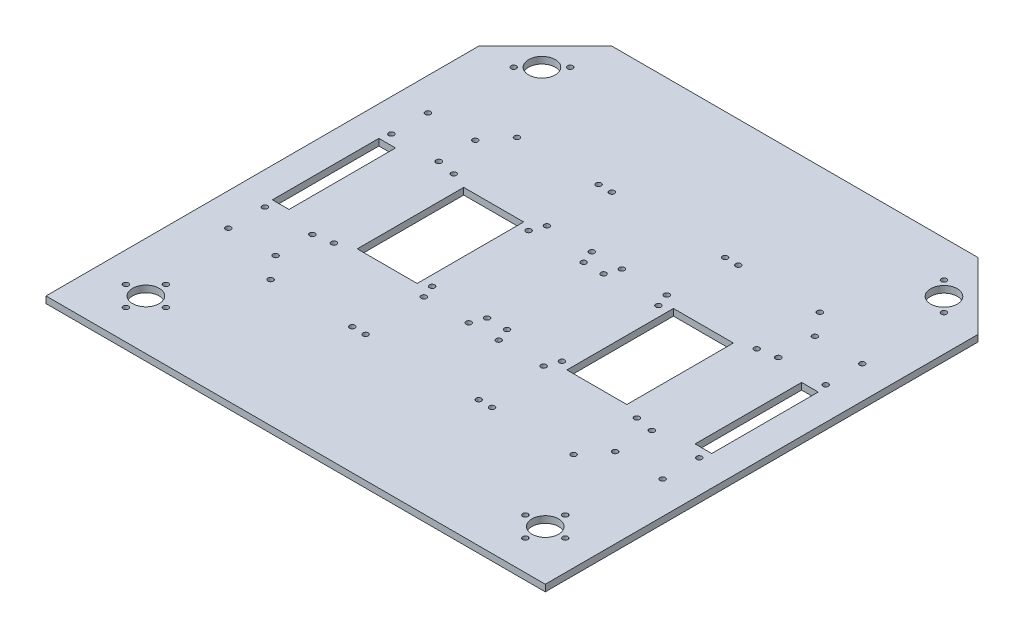
from build123d import *

# Parameters (mm, degrees)
ESQUISSE1_R             = 8
ESQUISSE1_R_2           = 1.6
BOSS_EXTRU_1_DEPTH      = 4
ESQUISSE3_R             = 1.6
ENL_V_MAT_EXTRU_1_DEPTH = 10
ESQUISSE4_W             = 36
ESQUISSE4_H             = 64
ENL_V_MAT_EXTRU_2_DEPTH = 5
ESQUISSE5_R             = 1.6
ENL_V_MAT_EXTRU_4_DEPTH = 5
ESQUISSE6_R             = 1.6
ESQUISSE6_R_2           = 1.621897971
ENL_V_MAT_EXTRU_5_DEPTH = 5
ENL_V_MAT_EXTRU_6_DEPTH = 5


with BuildPart() as part:
    # Esquisse1 → Boss.-Extru.1 (new body)
    with BuildSketch(Plane(origin=(0, 0, 0), x_dir=(1, 0, 0), z_dir=(0, 1, 0))):
        Polygon((-150, 0), (-150, 260), (-110, 300), (110, 300), (150, 260), (150, 0), align=None)
        with Locations((-119.984856992, 30)):
            Circle(ESQUISSE1_R, mode=Mode.SUBTRACT)
        with Locations((-120, 268)):
            Circle(ESQUISSE1_R, mode=Mode.SUBTRACT)
        with Locations((120, 269.55960862)):
            Circle(ESQUISSE1_R, mode=Mode.SUBTRACT)
        with Locations((-111.514718626, 276.485281374)):
            Circle(ESQUISSE1_R_2, mode=Mode.SUBTRACT)
        with Locations((-128.485281374, 259.514718626)):
            Circle(ESQUISSE1_R_2, mode=Mode.SUBTRACT)
        with Locations((111.514718626, 278.044889994)):
            Circle(ESQUISSE1_R_2, mode=Mode.SUBTRACT)
        with Locations((128.485281374, 261.074327245)):
            Circle(ESQUISSE1_R_2, mode=Mode.SUBTRACT)
        with Locations((120, 30)):
            Circle(ESQUISSE1_R, mode=Mode.SUBTRACT)
        with Locations((120, 42)):
            Circle(ESQUISSE1_R_2, mode=Mode.SUBTRACT)
        with Locations((-119.984856992, 42)):
            Circle(ESQUISSE1_R_2, mode=Mode.SUBTRACT)
        with Locations((-119.984856992, 18)):
            Circle(ESQUISSE1_R_2, mode=Mode.SUBTRACT)
        with Locations((120, 18)):
            Circle(ESQUISSE1_R_2, mode=Mode.SUBTRACT)
        with Locations((-131.984856992, 30)):
            Circle(ESQUISSE1_R_2, mode=Mode.SUBTRACT)
        with Locations((-107.984856992, 30)):
            Circle(ESQUISSE1_R_2, mode=Mode.SUBTRACT)
        with Locations((108, 30)):
            Circle(ESQUISSE1_R_2, mode=Mode.SUBTRACT)
        with Locations((132, 30)):
            Circle(ESQUISSE1_R_2, mode=Mode.SUBTRACT)
    extrude(amount=BOSS_EXTRU_1_DEPTH)

    # Esquisse3 → Enlèv. mat.-Extru.1 (cut)
    with BuildSketch(Plane(origin=(0, 4, 0), x_dir=(1, 0, 0), z_dir=(0, 1, 0))):
        with Locations((-9, 113)):
            Circle(ESQUISSE3_R)
        with Locations((-6, 179)):
            Circle(ESQUISSE3_R)
        with Locations((-39, 179)):
            Circle(ESQUISSE3_R)
        with Locations((-36, 113)):
            Circle(ESQUISSE3_R)
        with Locations((9, 187)):
            Circle(ESQUISSE3_R)
        with Locations((36, 187)):
            Circle(ESQUISSE3_R)
        with Locations((39, 121)):
            Circle(ESQUISSE3_R)
        with Locations((6, 121)):
            Circle(ESQUISSE3_R)
    enl_v_mat_extru_1 = extrude(amount=-ENL_V_MAT_EXTRU_1_DEPTH, mode=Mode.SUBTRACT)

    # Esquisse4 → Enlèv. mat.-Extru.2 (cut)
    with BuildSketch(Plane(origin=(0, 4, 0), x_dir=(1, 0, 0), z_dir=(0, 1, 0))):
        with Locations((-63, 150)):
            Rectangle(ESQUISSE4_W, ESQUISSE4_H)
        with Locations((63, 150)):
            Rectangle(ESQUISSE4_W, ESQUISSE4_H)
    extrude(amount=-ENL_V_MAT_EXTRU_2_DEPTH, mode=Mode.SUBTRACT)

    # Symétrie1: Enlèv. mat.-Extru.1 across plane
    add(enl_v_mat_extru_1.mirror(Plane(origin=(0, 0, 0), x_dir=(0, 0, 1), z_dir=(1, 0, 0))), mode=Mode.SUBTRACT)

    # Esquisse5 → Enlèv. mat.-Extru.4 (cut)
    with BuildSketch(Plane(origin=(0, 4, 0), x_dir=(1, 0, 0), z_dir=(0, 1, 0))):
        with Locations((-42, 224)):
            Circle(ESQUISSE5_R)
        with Locations((-34, 224)):
            Circle(ESQUISSE5_R)
        with Locations((34, 76)):
            Circle(ESQUISSE5_R)
        with Locations((42, 76)):
            Circle(ESQUISSE5_R)
        with Locations((91, 114)):
            Circle(ESQUISSE5_R)
        with Locations((91, 76)):
            Circle(ESQUISSE5_R)
        with Locations((-91, 224)):
            Circle(ESQUISSE5_R)
        with Locations((-91, 186)):
            Circle(ESQUISSE5_R)
    enl_v_mat_extru_4 = extrude(amount=-ENL_V_MAT_EXTRU_4_DEPTH, mode=Mode.SUBTRACT)

    # Symétrie4: Enlèv. mat.-Extru.4 across plane
    add(enl_v_mat_extru_4.mirror(Plane(origin=(0, 0, 0), x_dir=(0, 0, 1), z_dir=(1, 0, 0))), mode=Mode.SUBTRACT)

    # Esquisse6 → Enlèv. mat.-Extru.5 (cut)
    with BuildSketch(Plane(origin=(0, 4, 0), x_dir=(1, 0, 0), z_dir=(0, 1, 0))):
        with Locations((-102, 112)):
            Circle(ESQUISSE6_R)
        with Locations((-102, 90)):
            Circle(ESQUISSE6_R)
        with Locations((102, 188)):
            Circle(ESQUISSE6_R_2)
        with Locations((102, 210)):
            Circle(ESQUISSE6_R)
        with Locations((-130.5, 112)):
            Circle(ESQUISSE6_R)
        with Locations((-130.5, 90)):
            Circle(ESQUISSE6_R)
        with Locations((130.5, 210)):
            Circle(ESQUISSE6_R)
        with Locations((130.5, 188)):
            Circle(ESQUISSE6_R)
    enl_v_mat_extru_5 = extrude(amount=-ENL_V_MAT_EXTRU_5_DEPTH, mode=Mode.SUBTRACT)

    # Esquisse7 → Enlèv. mat.-Extru.6 (cut)
    with BuildSketch(Plane(origin=(0, 4, 0), x_dir=(1, 0, 0), z_dir=(0, 1, 0))):
        Polygon((-122, 150), (-122, 182), (-132, 182), (-132, 118), (-122, 118), align=None)
    enl_v_mat_extru_6 = extrude(amount=-ENL_V_MAT_EXTRU_6_DEPTH, mode=Mode.SUBTRACT)

    # Symétrie5: Enlèv. mat.-Extru.6 across plane
    add(enl_v_mat_extru_6.mirror(Plane(origin=(0, 0, 0), x_dir=(0, 0, 1), z_dir=(1, 0, 0))), mode=Mode.SUBTRACT)

    # Symétrie6: Enlèv. mat.-Extru.5 across plane
    add(enl_v_mat_extru_5.mirror(Plane(origin=(0, 0, 0), x_dir=(0, 0, 1), z_dir=(1, 0, 0))), mode=Mode.SUBTRACT)


solid = part.part
